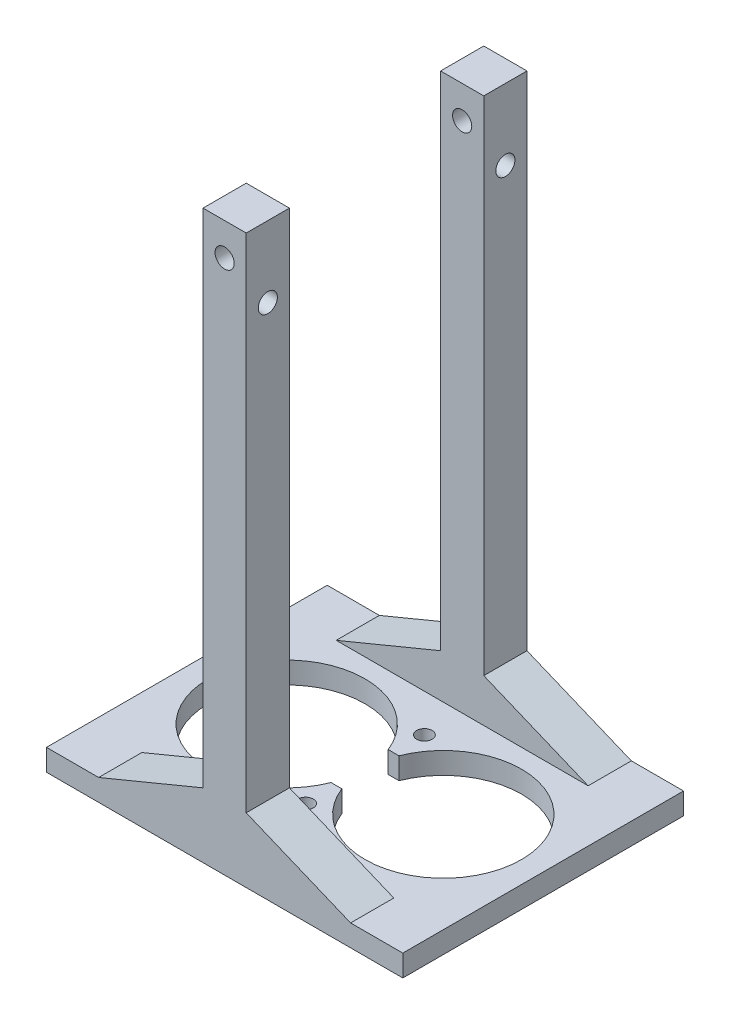
from build123d import *

# Parameters (mm, degrees)
BOSS_EXTRUDE1_DEPTH = 4
SKETCH3_R           = 1.427241696
CUT_EXTRUDE1_DEPTH  = 62.578957395
SKETCH4_W           = 8
SKETCH4_H           = 8
BOSS_EXTRUDE3_DEPTH = 105
CUT_EXTRUDE2_REACH  = 131.405
SKETCH5_R           = 1.775
SKETCH6_R           = 1.775
CUT_EXTRUDE3_DEPTH  = 117.867981735
BOSS_EXTRUDE4_DEPTH = 8
BOSS_EXTRUDE5_DEPTH = 8


with BuildPart() as part:
    # Sketch1 → Boss-Extrude1 (new body)
    with BuildSketch(Plane(origin=(0, 0, 0), x_dir=(1, 0, 0), z_dir=(0, 1, 0))):
        Polygon((-36.424634211, -27.554537751), (-7.424634211, -27.554537751), (11.075365789, -27.554537751), (11.075365789, 8.445462249), (-7.424634211, 8.445462249), (-36.424634211, 8.445462249), (-54.924634211, 8.445462249), (-54.924634211, -27.554537751), align=None)
        with BuildLine():
            Line((-22.924634211, -4.263035129), (-20.924634211, -4.263035129))
            ThreePointArc((-20.924634211, -4.263035129), (7.075365789, -9.554537751), (-20.924634211, -14.846040373))
            Line((-20.924634211, -14.846040373), (-22.924634211, -14.846040373))
            ThreePointArc((-22.924634211, -14.846040373), (-50.924634211, -9.554537751), (-22.924634211, -4.263035129))
        make_face(mode=Mode.SUBTRACT)
    extrude(amount=BOSS_EXTRUDE1_DEPTH)

    # Sketch3 → Cut-Extrude1 (cut, through all)
    with BuildSketch(Plane.XZ):
        with Locations(Location((-21.924634211, -1.445462249, 0), (0, 0, 270))):
            Circle(SKETCH3_R)
        with Locations(Location((-21.924634211, 20.554537751, 0), (0, 0, 270))):
            Circle(SKETCH3_R)
    extrude(amount=-CUT_EXTRUDE1_DEPTH, mode=Mode.SUBTRACT)

    # Sketch4 → Boss-Extrude3 (add)
    with BuildSketch(Plane.XZ):
        with Locations((-21.924634211, -12.445462249)):
            Rectangle(SKETCH4_W, SKETCH4_H)
        with Locations((-21.924634211, 31.554537751)):
            Rectangle(SKETCH4_W, SKETCH4_H)
    extrude(amount=-BOSS_EXTRUDE3_DEPTH)

    # Cut-Extrude2: up to this face of the body (flat: up to its plane)
    cut_extrude2_end = Plane(part.part.faces().sort_by_distance((-21.924634211, 52.5, -16.445462249))[0])
    # Sketch5 → Cut-Extrude2 (cut, up to the picked face)
    with BuildSketch(Plane.XY.offset(35.554537751), mode=Mode.PRIVATE) as cut_extrude2_sk1:
        with Locations((-21.924634211, 99)):
            Circle(SKETCH5_R)
    cut_extrude2_tool1 = split(extrude(cut_extrude2_sk1.sketch, amount=-CUT_EXTRUDE2_REACH, mode=Mode.PRIVATE), bisect_by=cut_extrude2_end, keep=Keep.BOTH, mode=Mode.PRIVATE)
    add(cut_extrude2_tool1.solids().sort_by(Axis((-21.924634, 99, 35.554538), (0, 0, -1)))[0], mode=Mode.SUBTRACT)

    # Sketch6 → Cut-Extrude3 (cut, through all)
    with BuildSketch(Plane(origin=(-17.924634211, 0, 0), x_dir=(0, 0, -1), z_dir=(1, 0, 0))):
        with Locations((-31.554537751, 91.839494298)):
            Circle(SKETCH6_R)
        with Locations((12.445462249, 91.839494298)):
            Circle(SKETCH6_R)
    extrude(amount=-CUT_EXTRUDE3_DEPTH, mode=Mode.SUBTRACT)

    # Sketch7 → Boss-Extrude4 (add)
    with BuildSketch(Plane.XY.offset(27.554537751)):
        Polygon((-45.257967544, 4), (-25.924634211, 12), (-25.924634211, 0), (-54.924634211, 0), (-54.924634211, 4), align=None)
        Polygon((-17.924634211, 0), (-17.924634211, 12), (1.408699123, 4), (11.075365789, 4), (11.075365789, 0), align=None)
    extrude(amount=BOSS_EXTRUDE4_DEPTH)

    # Sketch8 → Boss-Extrude5 (add)
    with BuildSketch(Plane(origin=(0, 0, -8.445462249), x_dir=(-1, 0, 0), z_dir=(0, 0, -1))):
        Polygon((-11.075365789, 0), (-11.075365789, 4), (-1.408699123, 4), (17.924634211, 12), (17.924634211, 0), align=None)
        Polygon((25.924634211, 12), (45.257967544, 4), (54.924634211, 4), (54.924634211, 0), (25.924634211, 0), align=None)
    extrude(amount=BOSS_EXTRUDE5_DEPTH)


solid = part.part
